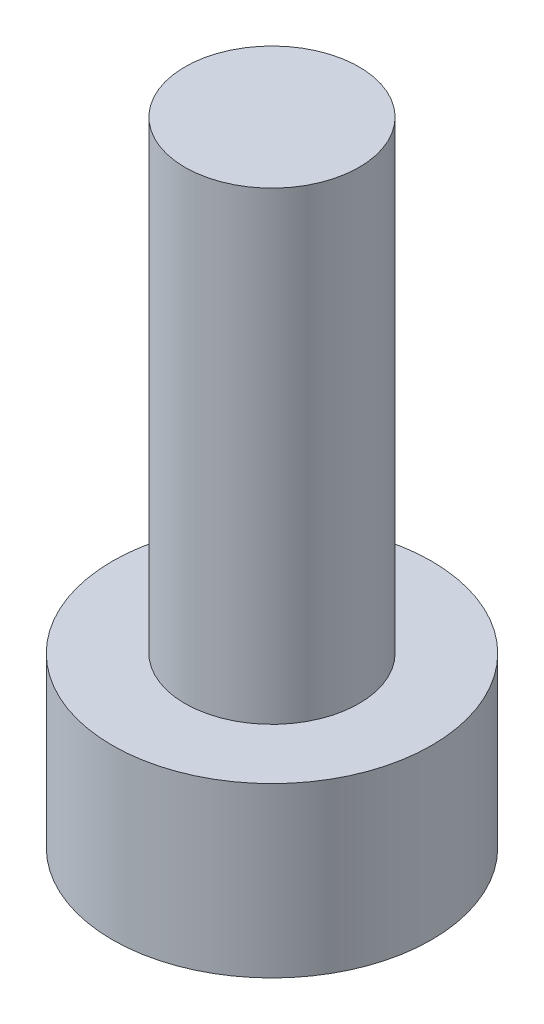
from build123d import *

# Parameters (mm, degrees)
SKETCH_1_R          = 1.5
EXTRUDE_1_DEPTH     = 8
SKETCH_2_R          = 2.75
EXTRUDE_2_DEPTH     = 2.9
CUT_EXTRUDE_1_DEPTH = 1.5


with BuildPart() as part:
    # 草图1 → 凸台-拉伸1 (new body)
    with BuildSketch(Plane(origin=(0, 0, 0), x_dir=(1, 0, 0), z_dir=(0, 1, 0))):
        with Locations(Location((0, 0, 0), (0, 0, 270))):
            Circle(SKETCH_1_R)
    extrude(amount=EXTRUDE_1_DEPTH)

    # 草图2 → 凸台-拉伸2 (add)
    with BuildSketch(Plane.XZ):
        with Locations(Location((0, 0, 0), (0, 0, 270))):
            Circle(SKETCH_2_R)
    extrude(amount=EXTRUDE_2_DEPTH)

    # 草图3 → 切除-拉伸1 (cut)
    with BuildSketch(Plane.XZ.offset(2.9)):
        Polygon((1.25, 0.721687836), (0, 1.443375673), (-1.25, 0.721687836), (-1.25, -0.721687836), (0, -1.443375673), (1.25, -0.721687836), align=None)
    extrude(amount=-CUT_EXTRUDE_1_DEPTH, mode=Mode.SUBTRACT)


solid = part.part
